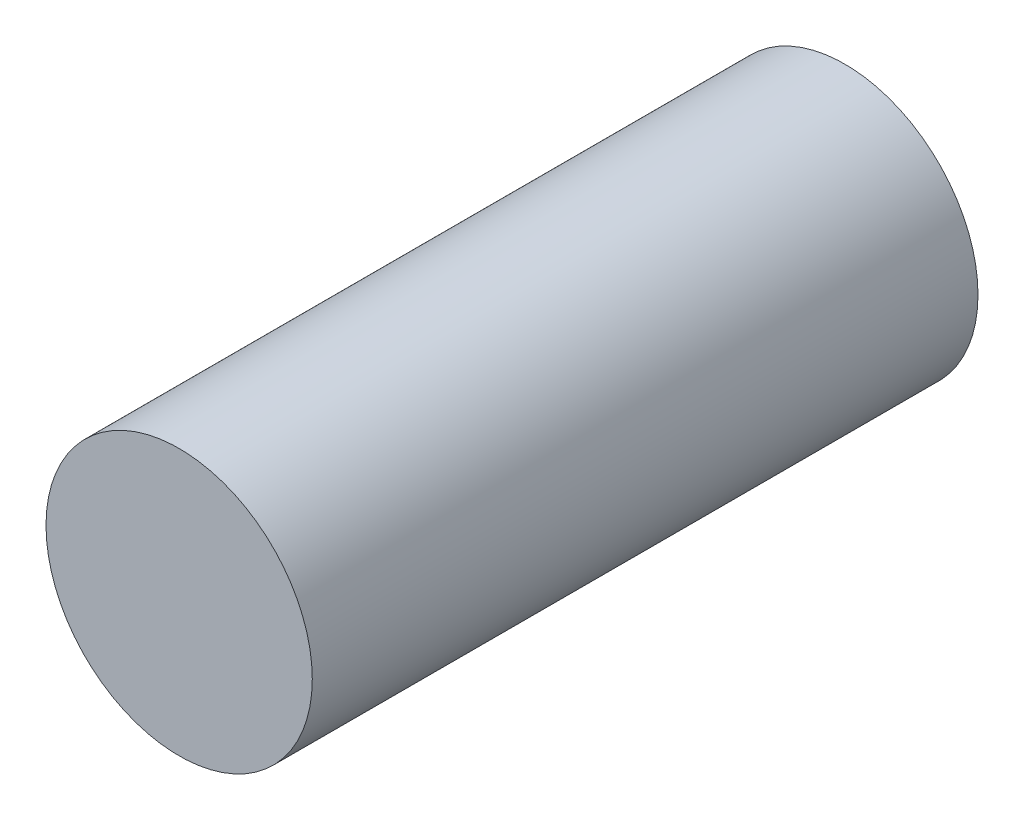
from build123d import *

# Parameters (mm, degrees)
SKETCH1_R           = 5.08
BOSS_EXTRUDE1_DEPTH = 25.4


with BuildPart() as part:
    # Sketch1 → Boss-Extrude1 (new body)
    with BuildSketch(Plane.XY):
        Circle(SKETCH1_R)
    extrude(amount=BOSS_EXTRUDE1_DEPTH)


solid = part.part
